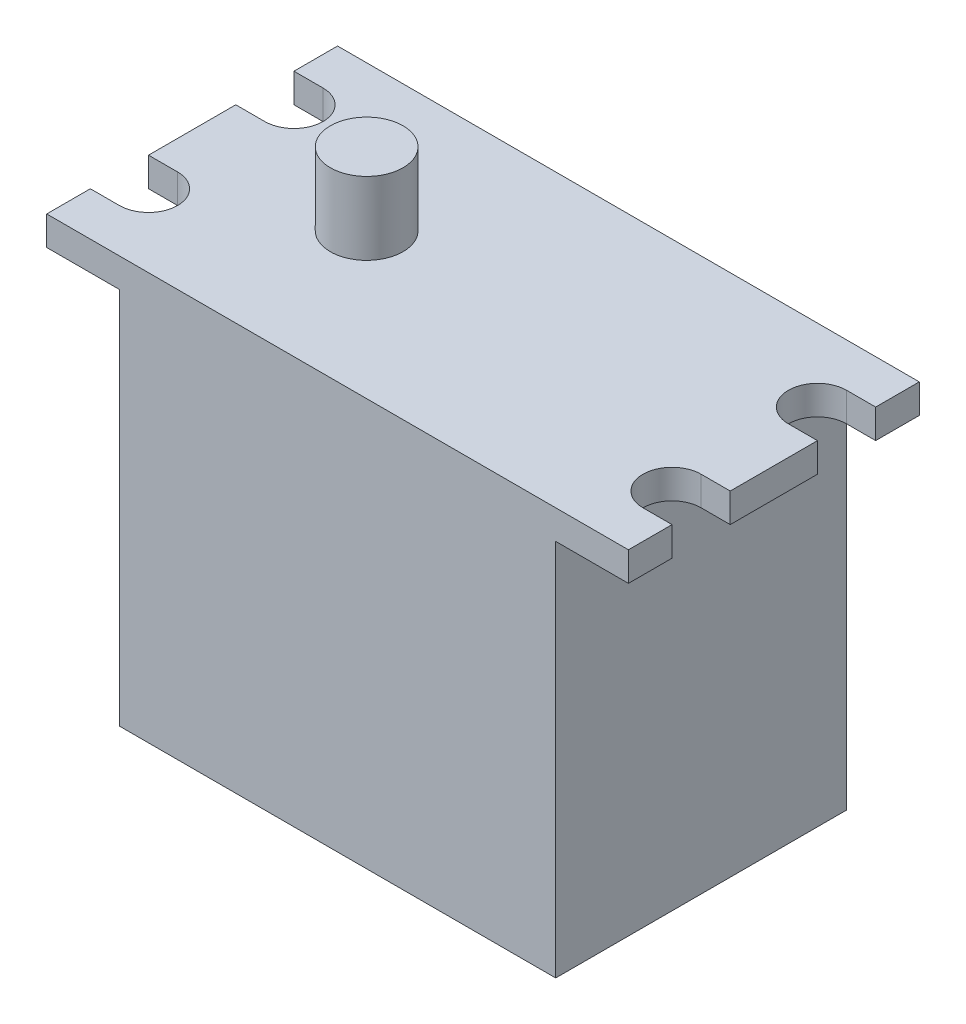
from build123d import *

# Parameters (mm, degrees)
SKETCH1_W           = 25.4
SKETCH1_H           = 12.7
BOSS_EXTRUDE1_DEPTH = 17.78
SKETCH2_W           = 3.175
SKETCH2_H           = 12.7
CUT_EXTRUDE1_DEPTH  = 16.51
SKETCH3_R           = 1.5875
BOSS_EXTRUDE2_DEPTH = 3.175
CUT_EXTRUDE2_DEPTH  = 23.753920541


with BuildPart() as part:
    # Sketch1 → Boss-Extrude1 (new body)
    with BuildSketch(Plane(origin=(0, 0, 0), x_dir=(1, 0, 0), z_dir=(0, 1, 0))):
        Rectangle(SKETCH1_W, SKETCH1_H)
    extrude(amount=BOSS_EXTRUDE1_DEPTH)

    # Sketch2 → Cut-Extrude1 (cut)
    with BuildSketch(Plane.XZ):
        with Locations((-11.1125, 0)):
            Rectangle(SKETCH2_W, SKETCH2_H)
        with Locations((11.1125, 0)):
            Rectangle(SKETCH2_W, SKETCH2_H)
    extrude(amount=-CUT_EXTRUDE1_DEPTH, mode=Mode.SUBTRACT)

    # Sketch3 → Boss-Extrude2 (add)
    with BuildSketch(Plane(origin=(0, 17.78, 0), x_dir=(1, 0, 0), z_dir=(0, 1, 0))):
        with Locations(Location((-5.08, 0, 0), (0, 0, 90))):
            Circle(SKETCH3_R)
    extrude(amount=BOSS_EXTRUDE2_DEPTH)

    # Sketch4 → Cut-Extrude2 (cut, through all)
    with BuildSketch(Plane(origin=(0, 17.78, 0), x_dir=(1, 0, 0), z_dir=(0, 1, 0))):
        with BuildLine():
            Line((-11.43, -4.445), (-12.7, -4.445))
            Line((-12.7, -4.445), (-12.7, -1.905))
            Line((-12.7, -1.905), (-11.43, -1.905))
            ThreePointArc((-11.43, -1.905), (-10.16, -3.175), (-11.43, -4.445))
        make_face()
        with BuildLine():
            Line((-11.43, 1.905), (-12.7, 1.905))
            Line((-12.7, 1.905), (-12.7, 4.445))
            Line((-12.7, 4.445), (-11.43, 4.445))
            ThreePointArc((-11.43, 4.445), (-10.16, 3.175), (-11.43, 1.905))
        make_face()
        with BuildLine():
            Line((12.7, 4.445), (11.43, 4.445))
            ThreePointArc((11.43, 4.445), (10.16, 3.175), (11.43, 1.905))
            Line((11.43, 1.905), (12.7, 1.905))
            Line((12.7, 1.905), (12.7, 4.445))
        make_face()
        with BuildLine():
            Line((12.7, -1.905), (11.43, -1.905))
            ThreePointArc((11.43, -1.905), (10.16, -3.175), (11.43, -4.445))
            Line((11.43, -4.445), (12.7, -4.445))
            Line((12.7, -4.445), (12.7, -1.905))
        make_face()
    extrude(amount=-CUT_EXTRUDE2_DEPTH, mode=Mode.SUBTRACT)


solid = part.part
